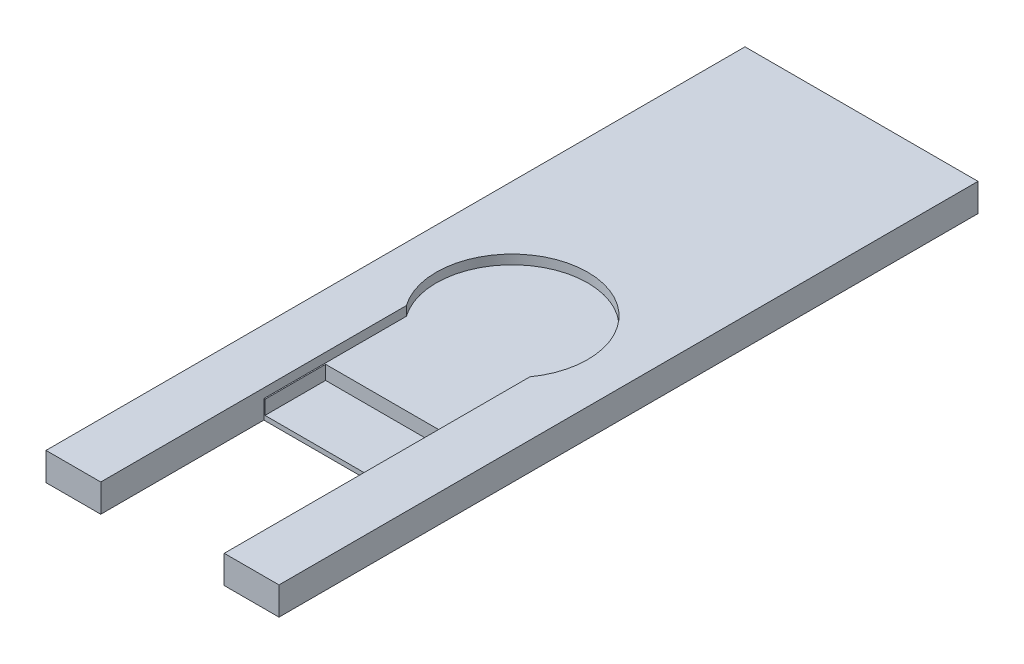
from build123d import *

# Parameters (mm, degrees)
SKETCH1_W           = 12.7
SKETCH1_H           = 38.1
BOSS_EXTRUDE1_DEPTH = 1.524
SKETCH2_W           = 6.604
SKETCH2_H           = 23.876
SKETCH2_W_2         = 5.334
SKETCH2_H_2         = 22.479000001
BOSS_EXTRUDE2_DEPTH = 2.032
CUT_EXTRUDE2_DEPTH  = 0.508
SKETCH6_W           = 6.731
SKETCH6_H           = 8.89
CUT_EXTRUDE3_DEPTH  = 30.669746225
SKETCH7_W           = 6.6675
SKETCH7_H           = 3.302
CUT_EXTRUDE4_DEPTH  = 0.762


with BuildPart() as part:
    # Sketch1 → Boss-Extrude1 (new body)
    with BuildSketch(Plane(origin=(0, 0, 0), x_dir=(1, 0, 0), z_dir=(0, 1, 0))):
        with Locations((1.262648046, -9.464051393)):
            Rectangle(SKETCH1_W, SKETCH1_H)
    extrude(amount=BOSS_EXTRUDE1_DEPTH)

    # Sketch2 → Boss-Extrude2 (add)
    with BuildSketch(Plane.XZ):
        with Locations((1.262648046, 5.019051392)):
            Rectangle(SKETCH2_W, SKETCH2_H)
        with Locations((1.262648046, 5.082551393)):
            Rectangle(SKETCH2_W_2, SKETCH2_H_2, mode=Mode.SUBTRACT)
    extrude(amount=BOSS_EXTRUDE2_DEPTH)

    # Sketch5 → Cut-Extrude2 (cut)
    with BuildSketch(Plane(origin=(0, 1.524, 0), x_dir=(1, 0, 0), z_dir=(0, 1, 0))):
        with BuildLine():
            Line((-2.102851954, -11.853542133), (-2.102851954, -28.514051393))
            Line((-2.102851954, -28.514051393), (4.628148046, -28.514051393))
            Line((4.628148046, -28.514051393), (4.628148046, -11.853542133))
            ThreePointArc((4.628148046, -11.853542133), (1.262648045, -5.336551393), (-2.102851954, -11.853542134))
        make_face()
    extrude(amount=-CUT_EXTRUDE2_DEPTH, mode=Mode.SUBTRACT)

    # Sketch6 → Cut-Extrude3 (cut, through all)
    with BuildSketch(Plane(origin=(0, 1.016, 0), x_dir=(1, 0, 0), z_dir=(0, 1, 0))):
        with Locations((1.262648046, -24.069051393)):
            Rectangle(SKETCH6_W, SKETCH6_H)
    extrude(amount=-CUT_EXTRUDE3_DEPTH, mode=Mode.SUBTRACT)

    # Sketch7 → Cut-Extrude4 (cut)
    with BuildSketch(Plane(origin=(0, 1.016, 0), x_dir=(1, 0, 0), z_dir=(0, 1, 0))):
        with Locations((1.294398046, -17.973051393)):
            Rectangle(SKETCH7_W, SKETCH7_H)
    extrude(amount=-CUT_EXTRUDE4_DEPTH, mode=Mode.SUBTRACT)


solid = part.part
